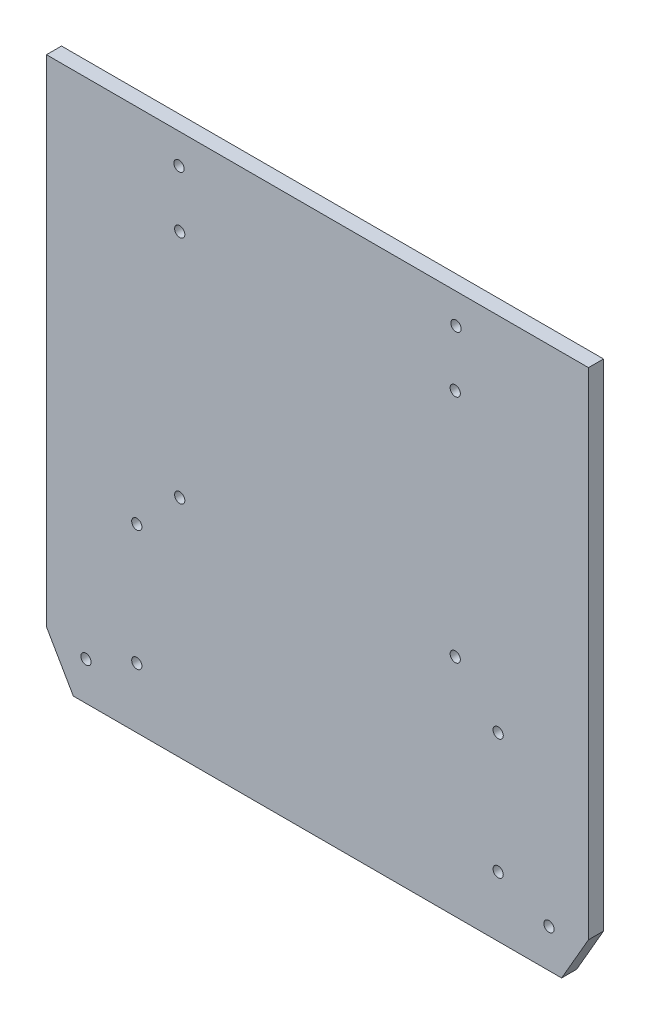
from build123d import *

# Parameters (mm, degrees)
SKETCH_1_W          = 180
SKETCH_1_H          = 180
EXTRUDE_1_DEPTH     = 5
SKETCH_2_R          = 1.7
CUT_EXTRUDE_1_DEPTH = 128.377392029
CUT_EXTRUDE_2_DEPTH = 128.377392029
SKETCH_4_R          = 1.7
CUT_EXTRUDE_3_DEPTH = 128.377392029
SKETCH_5_R          = 1.7
CUT_EXTRUDE_4_DEPTH = 128.377392029
SKETCH_6_R          = 1.7
CUT_EXTRUDE_5_DEPTH = 128.377392029


with BuildPart() as part:
    # 草圖1 → 填料-伸長1 (new body)
    with BuildSketch(Plane.XY):
        Rectangle(SKETCH_1_W, SKETCH_1_H)
    extrude(amount=EXTRUDE_1_DEPTH)

    # 草圖2 → 除料-伸長1 (cut, through all)
    with BuildSketch(Plane.XY.offset(5)):
        with Locations((-46, 80)):
            Circle(SKETCH_2_R)
        with Locations(Location((46, 80, 0), (0, 0, 180))):
            Circle(SKETCH_2_R)
    extrude(amount=-CUT_EXTRUDE_1_DEPTH, mode=Mode.SUBTRACT)

    # 草圖3 → 除料-伸長2 (cut, through all)
    with BuildSketch(Plane.XY.offset(5)):
        Polygon((-90, -90), (-81.076951546, -90), (-90, -74.544826719), align=None)
        Polygon((90, -90), (81.076951546, -90), (90, -74.544826719), align=None)
    extrude(amount=-CUT_EXTRUDE_2_DEPTH, mode=Mode.SUBTRACT)

    # 草圖4 → 除料-伸長3 (cut, through all)
    with BuildSketch(Plane.XY.offset(5)):
        with Locations((-76.878221735, -77.27241336)):
            Circle(SKETCH_4_R)
        with Locations(Location((76.878221735, -77.27241336, 0), (0, 0, 180))):
            Circle(SKETCH_4_R)
    extrude(amount=-CUT_EXTRUDE_3_DEPTH, mode=Mode.SUBTRACT)

    # 草圖5 → 除料-伸長4 (cut, through all)
    with BuildSketch(Plane.XY.offset(5)):
        with Locations((-45.75, 61.25)):
            Circle(SKETCH_5_R)
        with Locations(Location((45.75, 61.25, 0), (0, 0, 180))):
            Circle(SKETCH_5_R)
        with Locations((45.75, -15.25)):
            Circle(SKETCH_5_R)
        with Locations(Location((-45.75, -15.25, 0), (0, 0, 180))):
            Circle(SKETCH_5_R)
    extrude(amount=-CUT_EXTRUDE_4_DEPTH, mode=Mode.SUBTRACT)

    # 草圖6 → 除料-伸長5 (cut, through all)
    with BuildSketch(Plane.XY.offset(5)):
        with Locations((-60, -30)):
            Circle(SKETCH_6_R)
        with Locations((-60, -70)):
            Circle(SKETCH_6_R)
        with Locations(Location((60, -70, 0), (0, 0, 180))):
            Circle(SKETCH_6_R)
        with Locations(Location((60, -30, 0), (0, 0, 180))):
            Circle(SKETCH_6_R)
    extrude(amount=-CUT_EXTRUDE_5_DEPTH, mode=Mode.SUBTRACT)


solid = part.part
